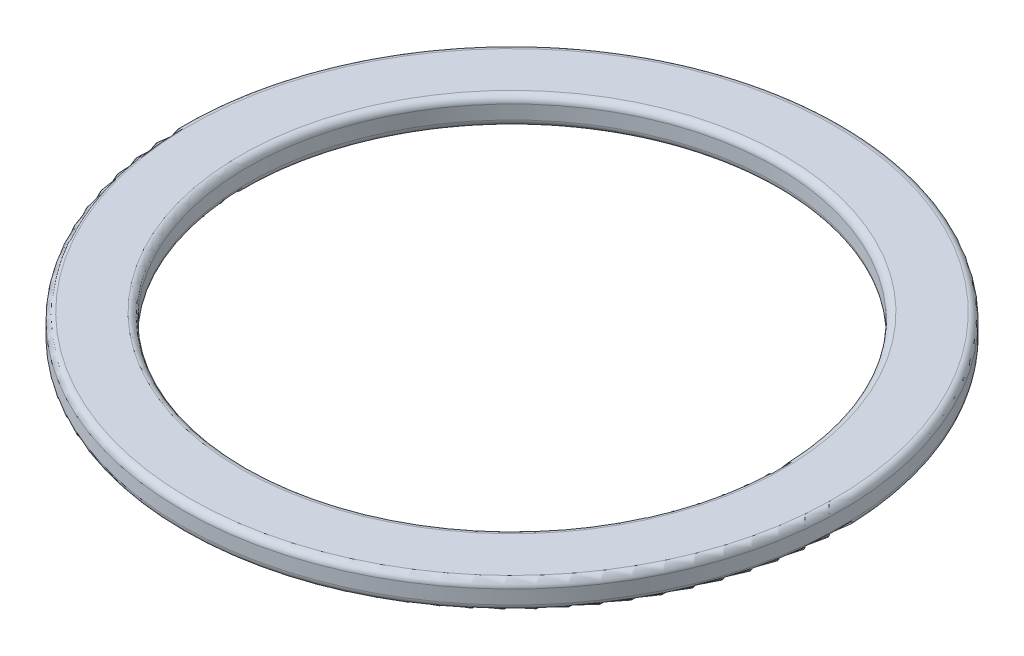
from build123d import *

# Parameters (mm, degrees)
SKETCH1_R           = 23.85
SKETCH1_R_2         = 19.15
BOSS_EXTRUDE1_DEPTH = 2
FILLET1_R           = 0.5


with BuildPart() as part:
    # Sketch1 → Boss-Extrude1 (new body)
    with BuildSketch(Plane(origin=(0, 0, 0), x_dir=(1, 0, 0), z_dir=(0, 1, 0))):
        with Locations(Location((0, 0, 0), (0, 0, 270))):
            Circle(SKETCH1_R)
        with Locations(Location((0, 0, 0), (0, 0, 270))):
            Circle(SKETCH1_R_2, mode=Mode.SUBTRACT)
    extrude(amount=BOSS_EXTRUDE1_DEPTH)

    # Fillet1
    fillet1_edges = [part.edges().sort_by_distance(p)[0] for p in [
        (0, 0, -23.85),
        (0, 2, -23.85),
        (0, 0, -19.15),
        (0, 2, -19.15),
    ]]
    fillet(fillet1_edges, radius=FILLET1_R)


solid = part.part
